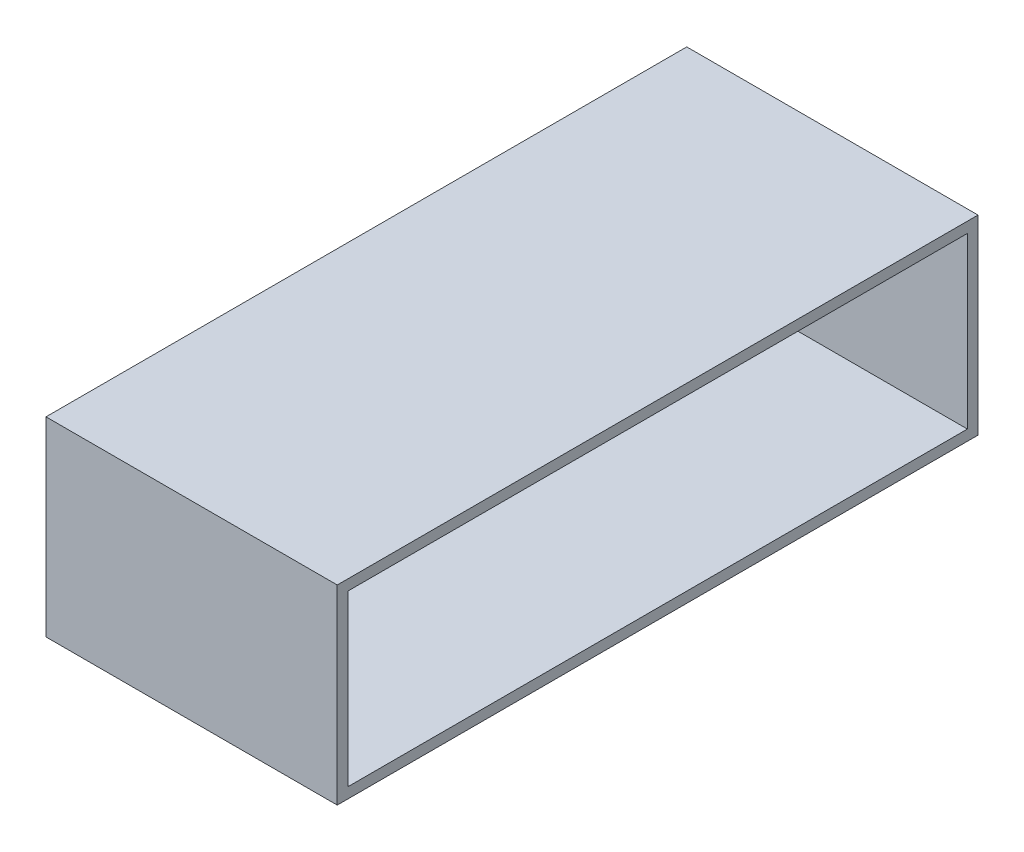
from build123d import *

# Parameters (mm, degrees)
SKETCH1_W           = 242
SKETCH1_H           = 72
BOSS_EXTRUDE1_DEPTH = 110
SHELL1_T            = -4


with BuildPart() as part:
    # Sketch1 → Boss-Extrude1 (new body)
    with BuildSketch(Plane(origin=(0, 0, 0), x_dir=(0, 0, -1), z_dir=(1, 0, 0))):
        Rectangle(SKETCH1_W, SKETCH1_H)
    extrude(amount=-BOSS_EXTRUDE1_DEPTH)

    # Shell1
    shell1_openings = [part.faces().sort_by_distance(p)[0] for p in [
        (0, 0, 0),
    ]]
    offset(amount=SHELL1_T, openings=shell1_openings, kind=Kind.INTERSECTION)


solid = part.part
